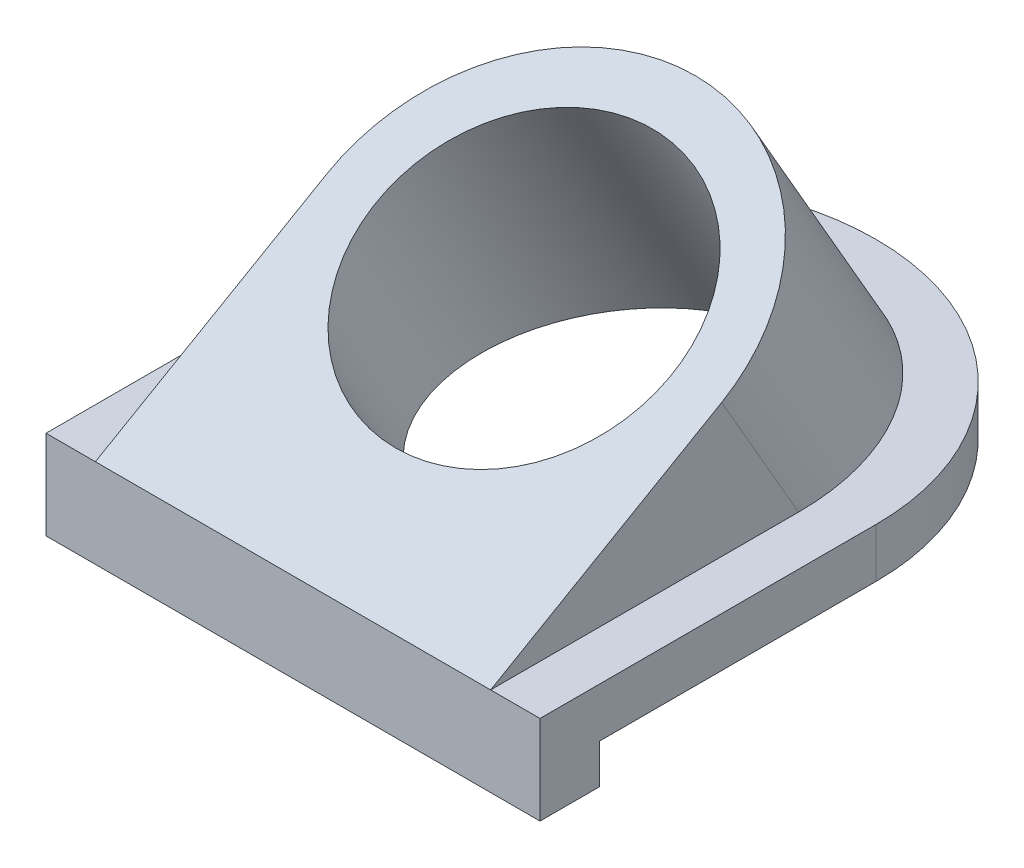
from build123d import *

# Parameters (mm, degrees)
EXTRUDE_3_DEPTH     = 18
SKETCH_8_W          = 100
SKETCH_8_H          = 106
CUT_EXTRUDE_1_DEPTH = 8
EXTRUDE_5_REACH     = 98.125
CUT_EXTRUDE_2_REACH = 98.125
SKETCH_18_R         = 30


with BuildPart() as part:
    # 草圖7 → 填料-伸長3 (new body)
    with BuildSketch(Plane(origin=(0, 0, 0), x_dir=(1, 0, 0), z_dir=(0, 1, 0))):
        with BuildLine():
            Line((-50, 0), (50, 0))
            Line((50, 0), (50, 68))
            ThreePointArc((50, 68), (0, 118), (-50, 68))
            Line((-50, 68), (-50, 0))
        make_face()
    extrude(amount=-EXTRUDE_3_DEPTH)

    # 草圖8 → 除料-伸長1 (cut)
    with BuildSketch(Plane.XZ.offset(18)):
        with Locations((0, -65)):
            Rectangle(SKETCH_8_W, SKETCH_8_H)
    extrude(amount=-CUT_EXTRUDE_1_DEPTH, mode=Mode.SUBTRACT)

    # 填料-伸長5: up to this face of the body (flat: up to its plane)
    extrude_5_end = Plane(part.part.faces().sort_by_distance((0, -10, -60.288575892))[0])
    # 草圖16 → 填料-伸長5 (add, up to the picked face)
    with BuildSketch(Plane(origin=(0, 29.444863729, -51), x_dir=(1, 0, 0), z_dir=(0, 0.866025403784436, 0.5000000000000044)), mode=Mode.PRIVATE) as extrude_5_sk1:
        with BuildLine():
            Line((-40, -58.889727457), (40, -58.889727457))
            Line((40, -58.889727457), (40, -4.889727457))
            ThreePointArc((40, -4.889727457), (0, 35.110272543), (-40, -4.889727457))
            Line((-40, -4.889727457), (-40, -58.889727457))
        make_face()
    extrude_5_tool1 = split(extrude(extrude_5_sk1.sketch, amount=-EXTRUDE_5_REACH, mode=Mode.PRIVATE), bisect_by=extrude_5_end, keep=Keep.BOTH, mode=Mode.PRIVATE)
    add(extrude_5_tool1.solids().sort_by(Axis((0, 21.58727, -37.390249), (0, -0.866025403784436, -0.5000000000000044)))[0])

    # 除料-伸長2: up to this plane
    cut_extrude_2_end = Plane(origin=(0, -10, 0), z_dir=(0, -1, 0))
    # 草圖18 → 除料-伸長2 (cut, up to the surface)
    with BuildSketch(Plane(origin=(0, 29.444863729, -51), x_dir=(1, 0, 0), z_dir=(0, 0.866025403784436, 0.5000000000000044)), mode=Mode.PRIVATE) as cut_extrude_2_sk1:
        with Locations(Location((0, -4.889727457, 0), (0, 0, 270))):
            Circle(SKETCH_18_R)
    cut_extrude_2_tool1 = split(extrude(cut_extrude_2_sk1.sketch, amount=-CUT_EXTRUDE_2_REACH, mode=Mode.PRIVATE), bisect_by=cut_extrude_2_end, keep=Keep.BOTH, mode=Mode.PRIVATE)
    add(cut_extrude_2_tool1.solids().sort_by_distance((0, 27, -46.765372))[0], mode=Mode.SUBTRACT)


solid = part.part
